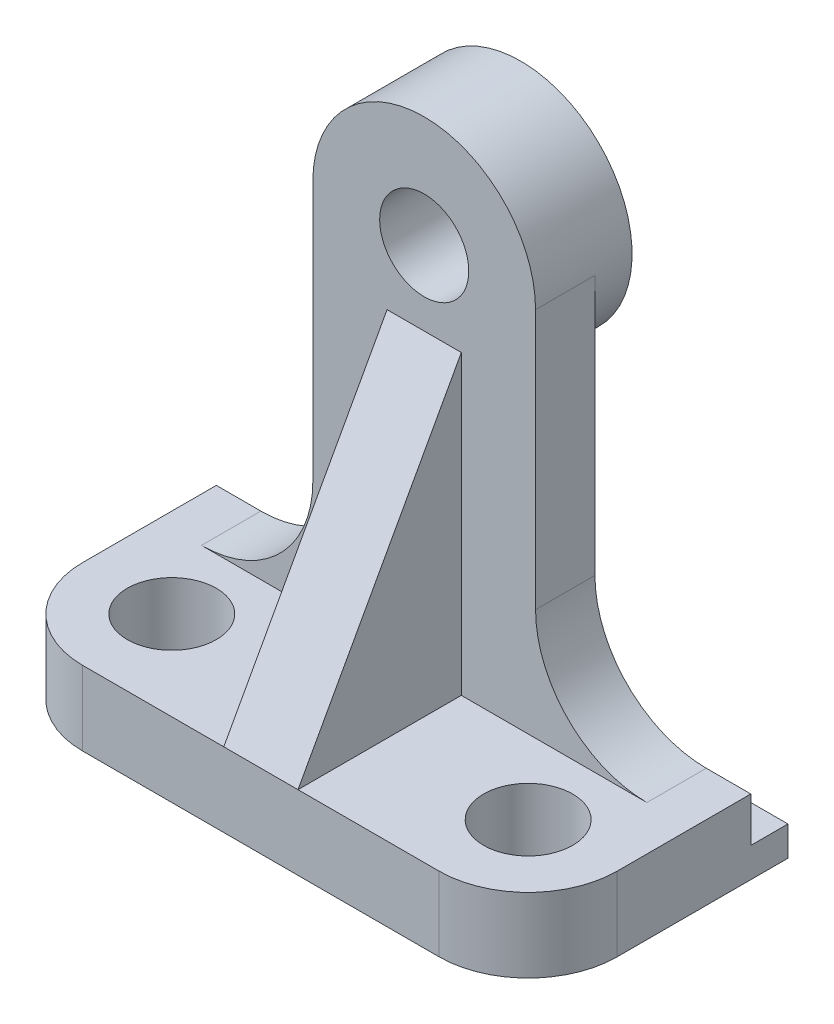
from build123d import *
from build123d.topology import SkipClean

# Parameters (mm, degrees)
SKETCH1_R           = 6
BOSS_EXTRUDE1_DEPTH = 4
SKETCH2_R           = 6
BOSS_EXTRUDE2_DEPTH = 6
SKETCH6_R           = 6
BOSS_EXTRUDE3_DEPTH = 8
BOSS_EXTRUDE4_START = 5
SKETCH7_R           = 6
BOSS_EXTRUDE4_DEPTH = 5
RIB1_REACH          = 87.013
SKETCH8_WALL_W      = 217.67731737
SKETCH8_WALL_H      = 10


with BuildPart() as part:
    # Sketch1 → Boss-Extrude1 (new body)
    with BuildSketch(Plane(origin=(0, 0, 0), x_dir=(1, 0, 0), z_dir=(0, 1, 0))):
        with BuildLine():
            Line((-36, 17.5), (36, 17.5))
            Line((36, 17.5), (36, -5.5))
            ThreePointArc((36, -5.5), (32.485281374, -13.985281374), (24, -17.5))
            Line((24, -17.5), (-24, -17.5))
            ThreePointArc((-24, -17.5), (-32.485281374, -13.985281374), (-36, -5.5))
            Line((-36, -5.5), (-36, 17.5))
        make_face()
        with Locations(Location((24, -5.5, 0), (0, 0, 270))):
            Circle(SKETCH1_R, mode=Mode.SUBTRACT)
        with Locations(Location((-24, -5.5, 0), (0, 0, 90))):
            Circle(SKETCH1_R, mode=Mode.SUBTRACT)
    extrude(amount=BOSS_EXTRUDE1_DEPTH)

    # Sketch2 → Boss-Extrude2 (add)
    with BuildSketch(Plane(origin=(0, 4, 0), x_dir=(1, 0, 0), z_dir=(0, 1, 0))):
        with BuildLine():
            Line((36, -5.5), (36, 12.5))
            Line((36, 12.5), (-36, 12.5))
            Line((-36, 12.5), (-36, -5.5))
            ThreePointArc((-36, -5.5), (-32.485281374, -13.985281374), (-24, -17.5))
            Line((-24, -17.5), (24, -17.5))
            ThreePointArc((24, -17.5), (32.485281374, -13.985281374), (36, -5.5))
        make_face()
        with Locations(Location((-24, -5.5, 0), (0, 0, 90))):
            Circle(SKETCH2_R, mode=Mode.SUBTRACT)
        with Locations(Location((24, -5.5, 0), (0, 0, 270))):
            Circle(SKETCH2_R, mode=Mode.SUBTRACT)
    extrude(amount=BOSS_EXTRUDE2_DEPTH)

    # Sketch6 → Boss-Extrude3 (add)
    with BuildSketch(Plane.XY.offset(-12.5)):
        with BuildLine():
            Line((15, 60), (15, 25))
            ThreePointArc((15, 25), (19.393398282, 14.393398282), (30, 10))
            Line((30, 10), (-30, 10))
            ThreePointArc((-30, 10), (-19.393398282, 14.393398282), (-15, 25))
            Line((-15, 25), (-15, 60))
            ThreePointArc((-15, 60), (0, 75), (15, 60))
        make_face()
        with Locations((0, 60)):
            Circle(SKETCH6_R, mode=Mode.SUBTRACT)
    extrude(amount=BOSS_EXTRUDE3_DEPTH)

    # Sketch7 → Boss-Extrude4 (add)
    with SkipClean():  # the faces are left unmerged after this step: merging them gives an invalid solid
        with BuildSketch(Plane(origin=(0, 0, -12.5), x_dir=(-1, 0, 0), z_dir=(0, 0, -1)).offset(BOSS_EXTRUDE4_START)):
            with BuildLine():
                ThreePointArc((15, 60), (0, 75), (-15, 60))
                ThreePointArc((-15, 60), (0, 45), (15, 60))
            make_face()
            with Locations((0, 60)):
                Circle(SKETCH7_R, mode=Mode.SUBTRACT)
        extrude(amount=-BOSS_EXTRUDE4_DEPTH)

    # Sketch8 wall → Rib1 (add, up to next)
    with BuildSketch(Plane(origin=(0, 30, 6.5), x_dir=(0, 0.876215908677, -0.481918749772), z_dir=(0, 0.481918749772, 0.876215908677)), mode=Mode.PRIVATE) as rib1_sk1:
        Rectangle(SKETCH8_WALL_W, SKETCH8_WALL_H)
    rib1_tool1 = extrude(rib1_sk1.sketch, amount=-RIB1_REACH, mode=Mode.PRIVATE) - part.part
    add(rib1_tool1.solids().sort_by_distance((0, 30, 6.5))[0])


solid = part.part
